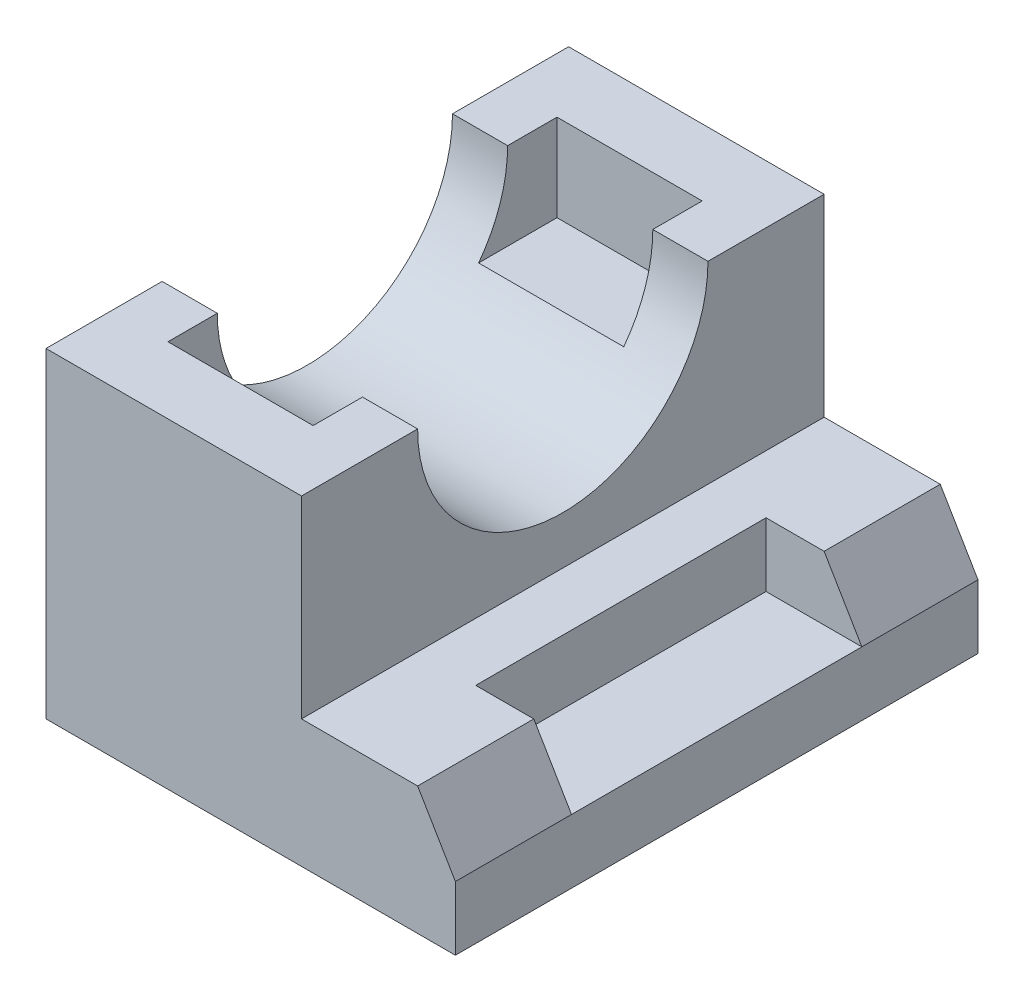
from build123d import *

# Parameters (mm, degrees)
BOSS_EXTRUDE1_DEPTH = 90
CUT_EXTRUDE3_DEPTH  = 11
SKETCH4_R           = 25
CUT_EXTRUDE4_DEPTH  = 44
SKETCH6_W           = 25
SKETCH6_H           = 15
CUT_EXTRUDE5_DEPTH  = 15


with BuildPart() as part:
    # Sketch1 → Boss-Extrude1 (new body)
    with BuildSketch(Plane.XY):
        Polygon((8.75, 27.625), (8.75, -5.625), (28.75, -5.625), (35.25, -16.625), (35.25, -27.625), (-35.25, -27.625), (-35.25, 27.625), align=None)
    extrude(amount=-BOSS_EXTRUDE1_DEPTH)

    # Sketch2 → Cut-Extrude3 (cut)
    with BuildSketch(Plane(origin=(0, -5.625, 0), x_dir=(1, 0, 0), z_dir=(0, 1, 0))):
        Polygon((18.75, 70), (28.75, 70), (35.25, 70), (35.25, 20), (28.75, 20), (18.75, 20), align=None)
    extrude(amount=-CUT_EXTRUDE3_DEPTH, mode=Mode.SUBTRACT)

    # Sketch4 → Cut-Extrude4 (cut)
    with BuildSketch(Plane(origin=(8.75, 0, 0), x_dir=(0, 0, -1), z_dir=(1, 0, 0))):
        with Locations((45, 27.625)):
            Circle(SKETCH4_R)
    extrude(amount=-CUT_EXTRUDE4_DEPTH, mode=Mode.SUBTRACT)

    # Sketch6 → Cut-Extrude5 (cut)
    with BuildSketch(Plane(origin=(0, 27.625, 0), x_dir=(1, 0, 0), z_dir=(0, 1, 0))):
        with Locations((-13.25, 71)):
            Rectangle(SKETCH6_W, SKETCH6_H)
        with Locations((-13.25, 19)):
            Rectangle(SKETCH6_W, SKETCH6_H)
    extrude(amount=-CUT_EXTRUDE5_DEPTH, mode=Mode.SUBTRACT)


solid = part.part
